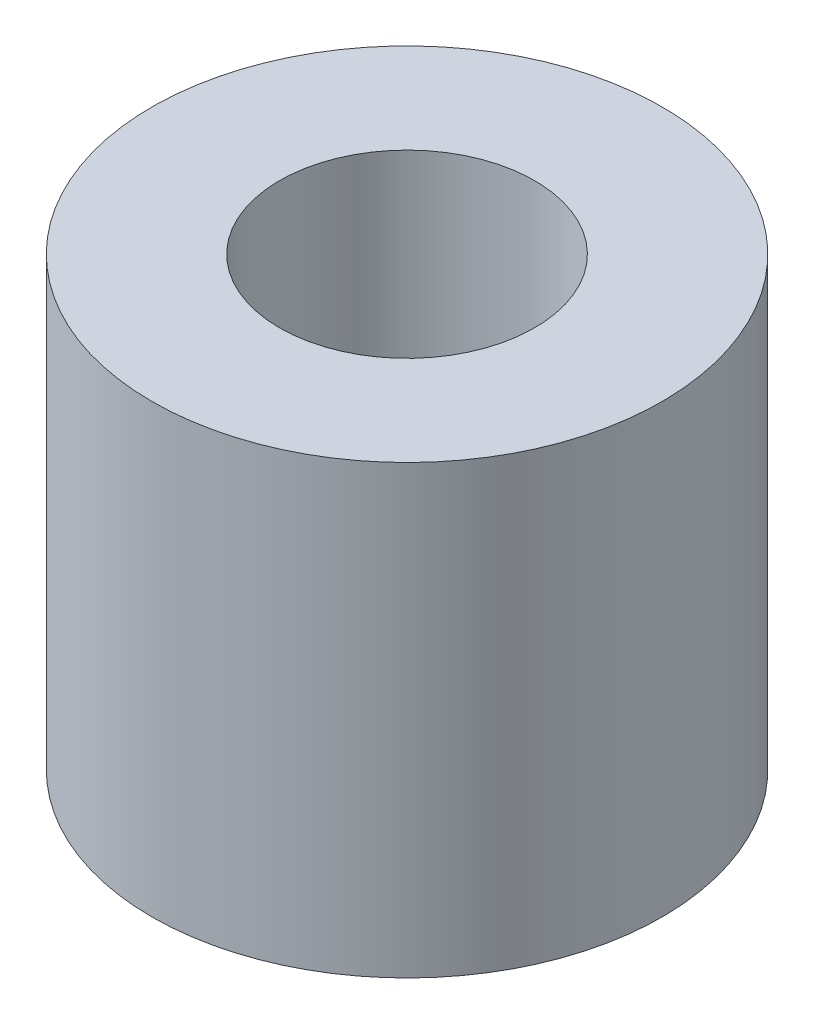
from build123d import *

# Parameters (mm, degrees)
SKETCH1_R           = 4
SKETCH1_R_2         = 2
BOSS_EXTRUDE1_DEPTH = 7


with BuildPart() as part:
    # Sketch1 → Boss-Extrude1 (new body)
    with BuildSketch(Plane(origin=(0, 0, 0), x_dir=(1, 0, 0), z_dir=(0, 1, 0))):
        with Locations(Location((0, 0, 0), (0, 0, 270))):
            Circle(SKETCH1_R)
        with Locations(Location((0, 0, 0), (0, 0, 270))):
            Circle(SKETCH1_R_2, mode=Mode.SUBTRACT)
    extrude(amount=BOSS_EXTRUDE1_DEPTH)


solid = part.part
